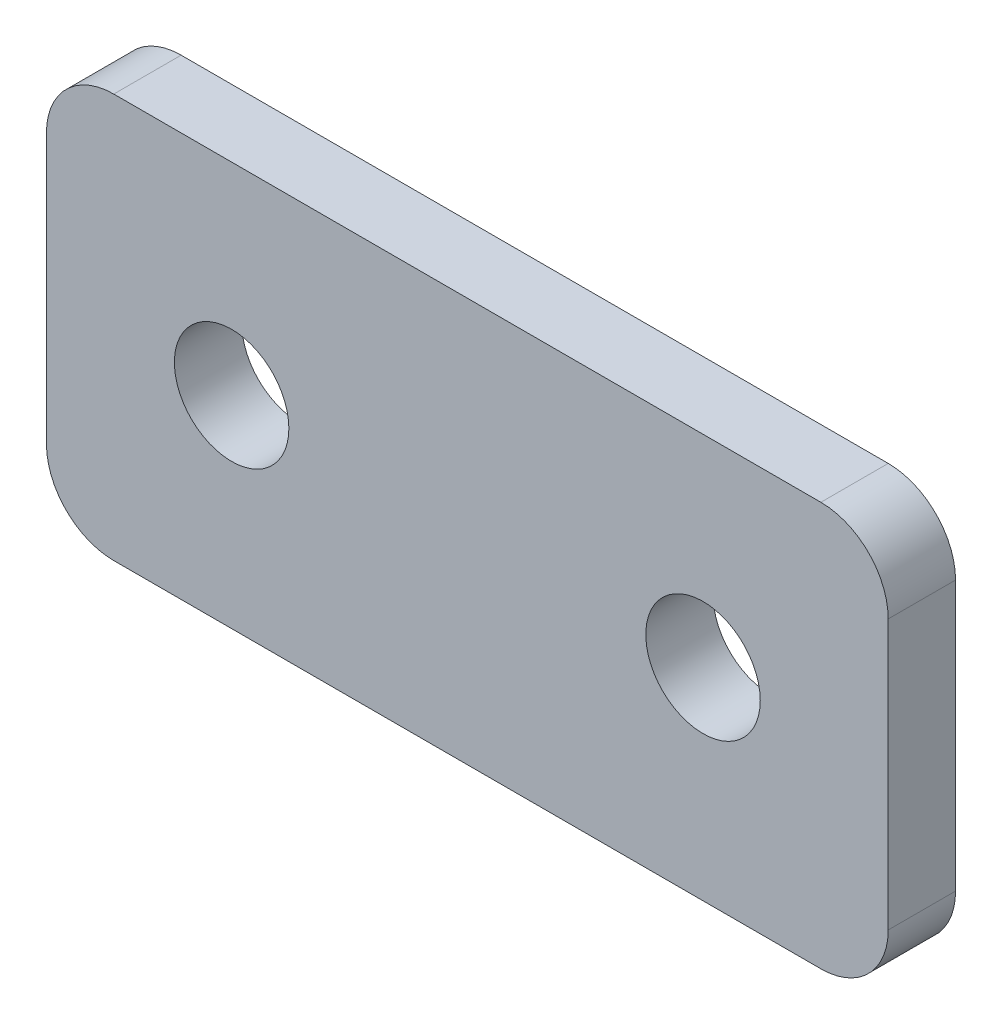
from build123d import *

# Parameters (mm, degrees)
SKETCH1_W            = 25
SKETCH1_H            = 12
BOSS_EXTRUDE1_DEPTH  = 2
M3_CLEARANCE_HOLE1_D = 3.4
FILLET1_R            = 2


with BuildPart() as part:
    # Sketch1 → Boss-Extrude1 (new body)
    with BuildSketch(Plane.XY):
        Rectangle(SKETCH1_W, SKETCH1_H)
    extrude(amount=BOSS_EXTRUDE1_DEPTH)

    # M3 Clearance Hole1 (through all)
    with Locations(Plane.XY.offset(2)):
        with Locations((-7, 0), (7, 0)):
            Hole(M3_CLEARANCE_HOLE1_D / 2)

    # Fillet1
    fillet1_edges = [part.edges().sort_by_distance(p)[0] for p in [
        (12.5, -6, 1),
        (-12.5, -6, 1),
        (-12.5, 6, 1),
        (12.5, 6, 1),
    ]]
    fillet(fillet1_edges, radius=FILLET1_R)


solid = part.part
